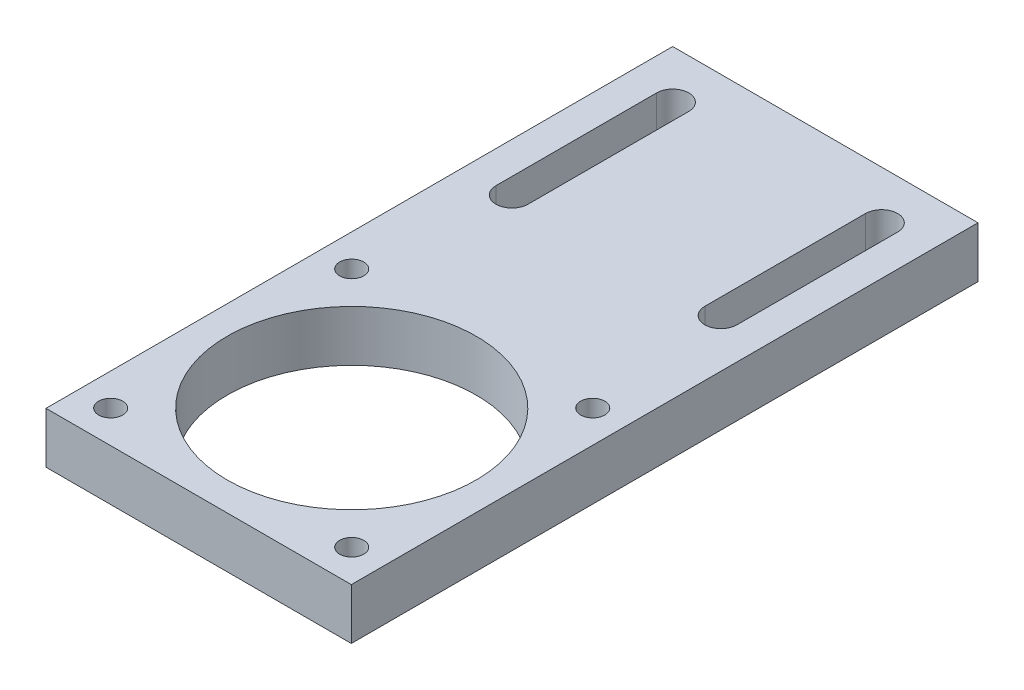
from build123d import *

# Parameters (mm, degrees)
SKETCH1_W           = 38
SKETCH1_H           = 78
SKETCH1_R           = 1.5
SKETCH1_R_2         = 15.5
BOSS_EXTRUDE1_DEPTH = 6.35


with BuildPart() as part:
    # Sketch1 → Boss-Extrude1 (new body)
    with BuildSketch(Plane(origin=(0, 0, 0), x_dir=(1, 0, 0), z_dir=(0, 1, 0))):
        with Locations((19, 39)):
            Rectangle(SKETCH1_W, SKETCH1_H)
        with Locations(Location((4, 4.05, 0), (0, 0, 270))):
            Circle(SKETCH1_R, mode=Mode.SUBTRACT)
        with Locations(Location((34, 4.05, 0), (0, 0, 270))):
            Circle(SKETCH1_R, mode=Mode.SUBTRACT)
        with Locations(Location((34, 34.05, 0), (0, 0, 270))):
            Circle(SKETCH1_R, mode=Mode.SUBTRACT)
        with Locations(Location((4, 34.05, 0), (0, 0, 270))):
            Circle(SKETCH1_R, mode=Mode.SUBTRACT)
        with Locations(Location((19, 19.05, 0), (0, 0, 270))):
            Circle(SKETCH1_R_2, mode=Mode.SUBTRACT)
        with BuildLine():
            Line((4, 72), (4, 52))
            ThreePointArc((4, 52), (6, 50), (8, 52))
            Line((8, 52), (8, 72))
            ThreePointArc((8, 72), (6, 74), (4, 72))
        make_face(mode=Mode.SUBTRACT)
        with BuildLine():
            Line((30, 72), (30, 52))
            ThreePointArc((30, 52), (32, 50), (34, 52))
            Line((34, 52), (34, 72))
            ThreePointArc((34, 72), (32, 74), (30, 72))
        make_face(mode=Mode.SUBTRACT)
    extrude(amount=BOSS_EXTRUDE1_DEPTH)


solid = part.part
